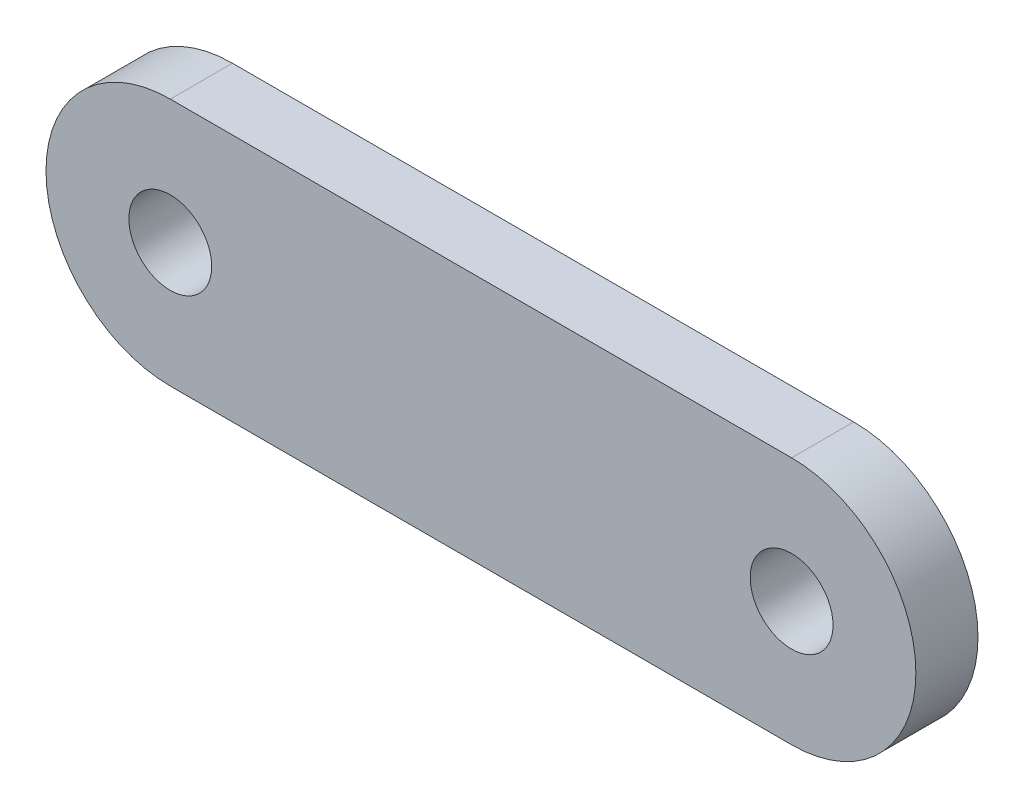
from build123d import *

# Parameters (mm, degrees)
SKETCH1_R           = 2
BOSS_EXTRUDE3_DEPTH = 3


with BuildPart() as part:
    # Sketch1 → Boss-Extrude3 (new body)
    with BuildSketch(Plane.XY):
        with BuildLine():
            Line((-35.312724167, 6), (-5.312724167, 6))
            ThreePointArc((-5.312724167, 6), (0.687275833, 0), (-5.312724167, -6))
            Line((-5.312724167, -6), (-35.312724167, -6))
            ThreePointArc((-35.312724167, -6), (-41.312724167, 0), (-35.312724167, 6))
        make_face()
        with Locations((-35.312724167, 0)):
            Circle(SKETCH1_R, mode=Mode.SUBTRACT)
        with Locations((-5.312724167, 0)):
            Circle(SKETCH1_R, mode=Mode.SUBTRACT)
    extrude(amount=BOSS_EXTRUDE3_DEPTH)


solid = part.part
